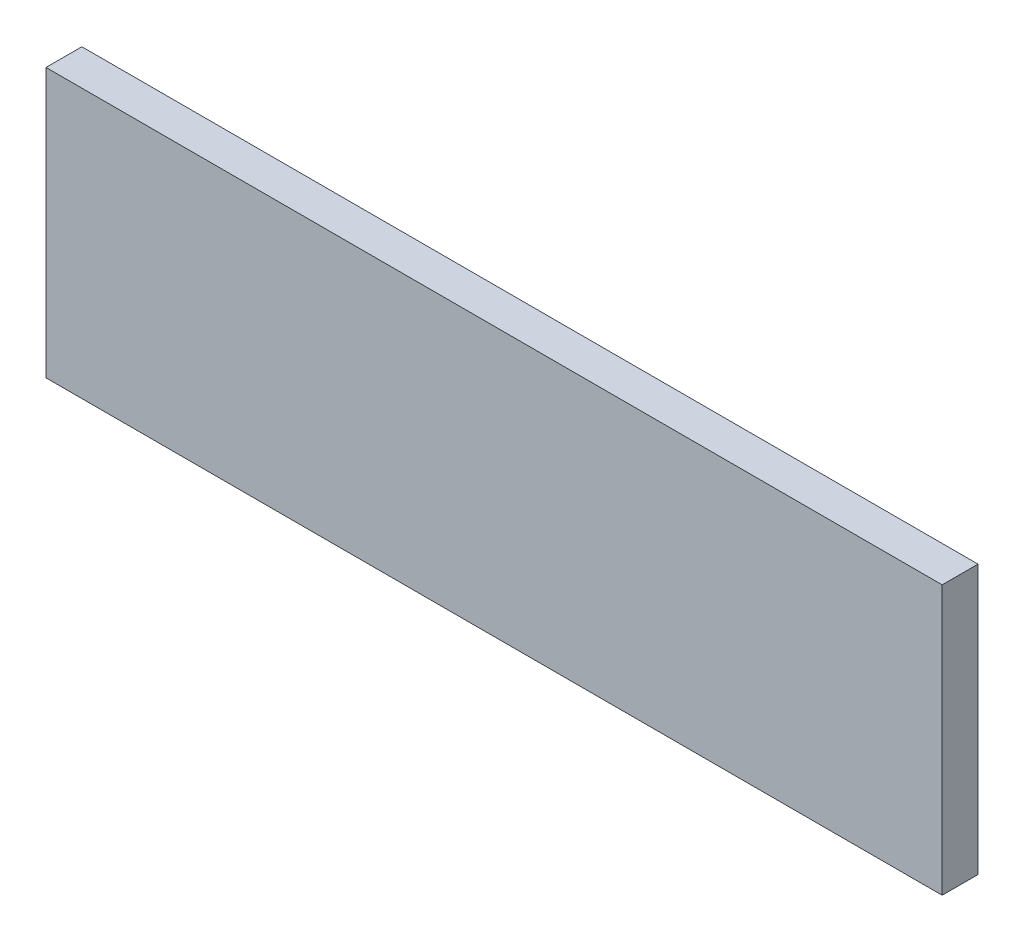
from build123d import *

# Parameters (mm, degrees)
SKETCH1_W           = 250
SKETCH1_H           = 75
BOSS_EXTRUDE1_DEPTH = 10


with BuildPart() as part:
    # Sketch1 → Boss-Extrude1 (new body)
    with BuildSketch(Plane.XY):
        Rectangle(SKETCH1_W, SKETCH1_H)
    extrude(amount=BOSS_EXTRUDE1_DEPTH)


solid = part.part
